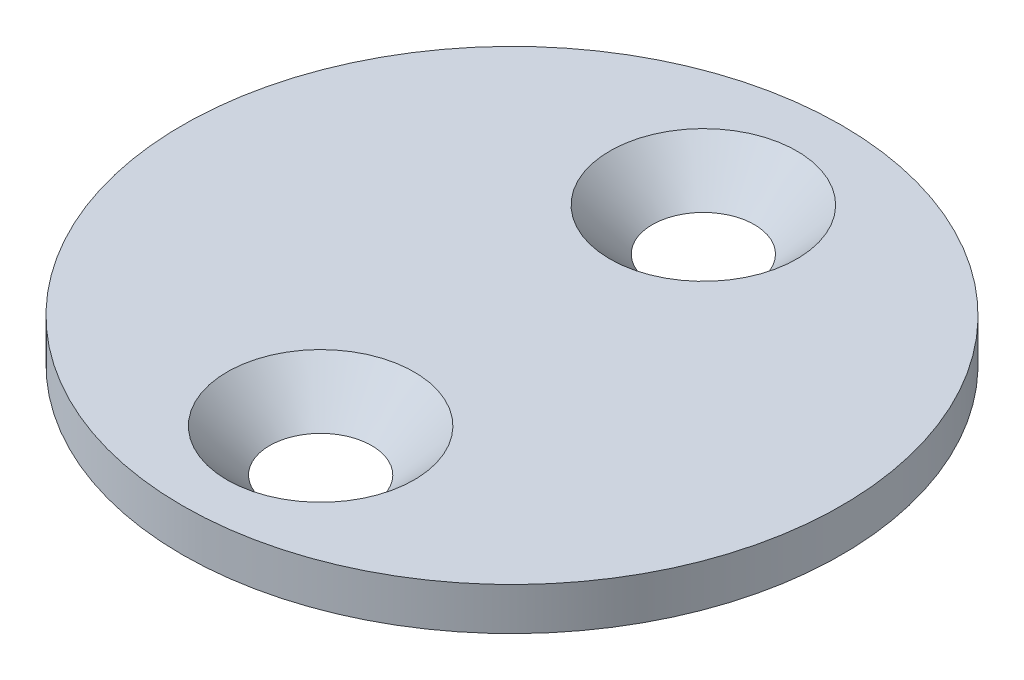
from build123d import *

# Parameters (mm, degrees)
SKETCH1_R                                       = 7.75
BOSS_EXTRUDE1_DEPTH                             = 1
CSK_FOR_M2_FLAT_HEAD_MACHINE_SCREW3_D           = 2.4
CSK_FOR_M2_FLAT_HEAD_MACHINE_SCREW3_DEPTH       = 2
CSK_FOR_M2_FLAT_HEAD_MACHINE_SCREW3_CSINK_D     = 4.4
CSK_FOR_M2_FLAT_HEAD_MACHINE_SCREW3_CSINK_ANGLE = 90
CSK_FOR_M2_FLAT_HEAD_MACHINE_SCREW3_TIP         = 0.721032743


with BuildPart() as part:
    # Sketch1 → Boss-Extrude1 (new body)
    with BuildSketch(Plane(origin=(0, 0, 0), x_dir=(1, 0, 0), z_dir=(0, 1, 0))):
        with Locations(Location((0, 0, 0), (0, 0, 270))):
            Circle(SKETCH1_R)
    extrude(amount=BOSS_EXTRUDE1_DEPTH)

    # CSK for M2 Flat Head Machine Screw3
    with Locations(Plane(origin=(0, 1, 4.5), x_dir=(0, 0, 1), z_dir=(0, 1, 0))):
        with Locations((0, 0), (-9, 0)):
            CounterSinkHole(CSK_FOR_M2_FLAT_HEAD_MACHINE_SCREW3_D / 2, CSK_FOR_M2_FLAT_HEAD_MACHINE_SCREW3_CSINK_D / 2, depth=CSK_FOR_M2_FLAT_HEAD_MACHINE_SCREW3_DEPTH, counter_sink_angle=CSK_FOR_M2_FLAT_HEAD_MACHINE_SCREW3_CSINK_ANGLE)
            with Locations((0, 0, -(CSK_FOR_M2_FLAT_HEAD_MACHINE_SCREW3_DEPTH + CSK_FOR_M2_FLAT_HEAD_MACHINE_SCREW3_TIP / 2))):  # 118° drill point
                Cone(0, CSK_FOR_M2_FLAT_HEAD_MACHINE_SCREW3_D / 2, CSK_FOR_M2_FLAT_HEAD_MACHINE_SCREW3_TIP, mode=Mode.SUBTRACT)


solid = part.part
